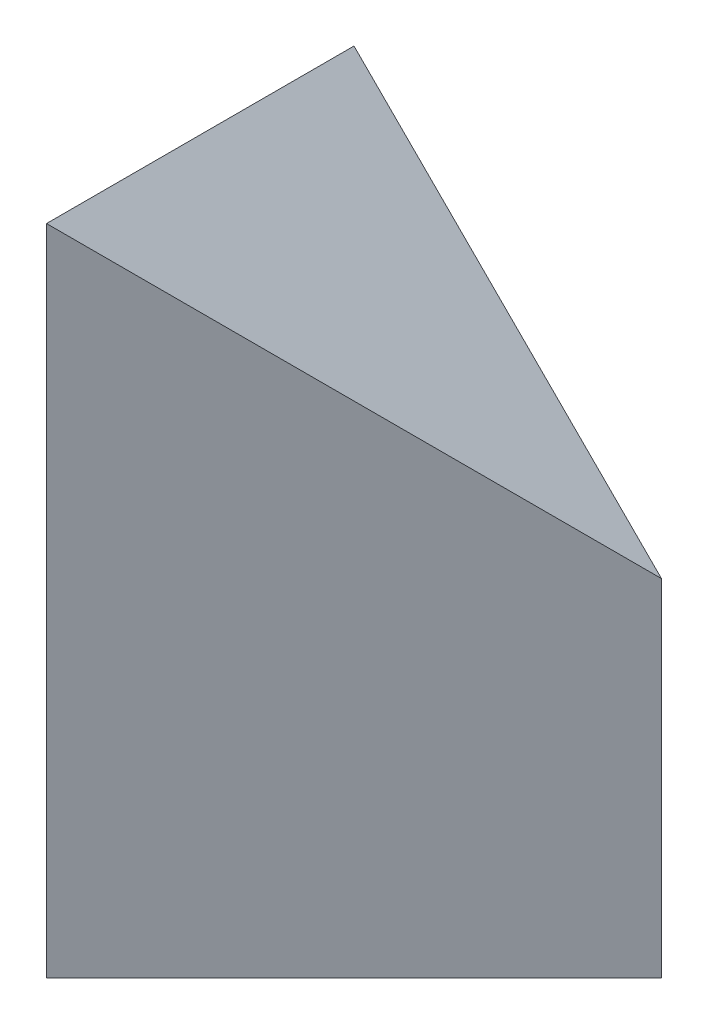
from build123d import *

# Parameters (mm, degrees)
BOSS_EXTRUDE1_DEPTH     = 107.95
CUT_EXTRUDE1_DEPTH      = 122.979516723
CUT_EXTRUDE1_DEPTH_BACK = 122.979516723


with BuildPart() as part:
    # Sketch1 → Boss-Extrude1 (new body)
    with BuildSketch(Plane(origin=(0, 0, 0), x_dir=(1, 0, 0), z_dir=(0, 1, 0))):
        Polygon((50.8, 25.4), (0, 25.4), (0, -25.4), align=None)
    extrude(amount=BOSS_EXTRUDE1_DEPTH)

    # Sketch2 → Cut-Extrude1 (cut, two sides: drawn at the far end of the back side and taken through both)
    with BuildSketch(Plane.XY.offset(-CUT_EXTRUDE1_DEPTH_BACK)):
        Polygon((-175.794762058, 283.744762058), (0, 107.95), (50.8, 57.15), (226.594762058, -118.644762058), (578.184286173, 232.944762058), (175.794762058, 635.334286173), align=None)
    extrude(amount=CUT_EXTRUDE1_DEPTH + CUT_EXTRUDE1_DEPTH_BACK, mode=Mode.SUBTRACT)


solid = part.part
